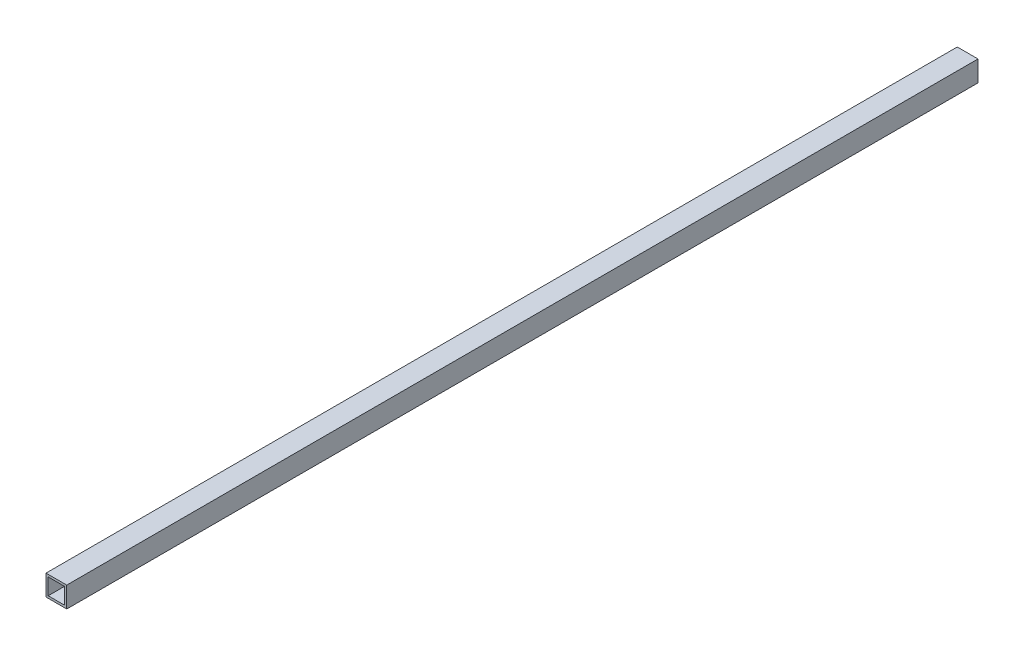
from build123d import *

# Parameters (mm, degrees)
SKETCH_1_W      = 14
SKETCH_1_H      = 14
SKETCH_1_W_2    = 11
SKETCH_1_H_2    = 11
EXTRUDE_1_DEPTH = 615


with BuildPart() as part:
    # 草图1 → 拉伸-薄壁1 (new body)
    with BuildSketch(Plane.XY):
        Rectangle(SKETCH_1_W, SKETCH_1_H)
        Rectangle(SKETCH_1_W_2, SKETCH_1_H_2, mode=Mode.SUBTRACT)
    extrude(amount=EXTRUDE_1_DEPTH)


solid = part.part
